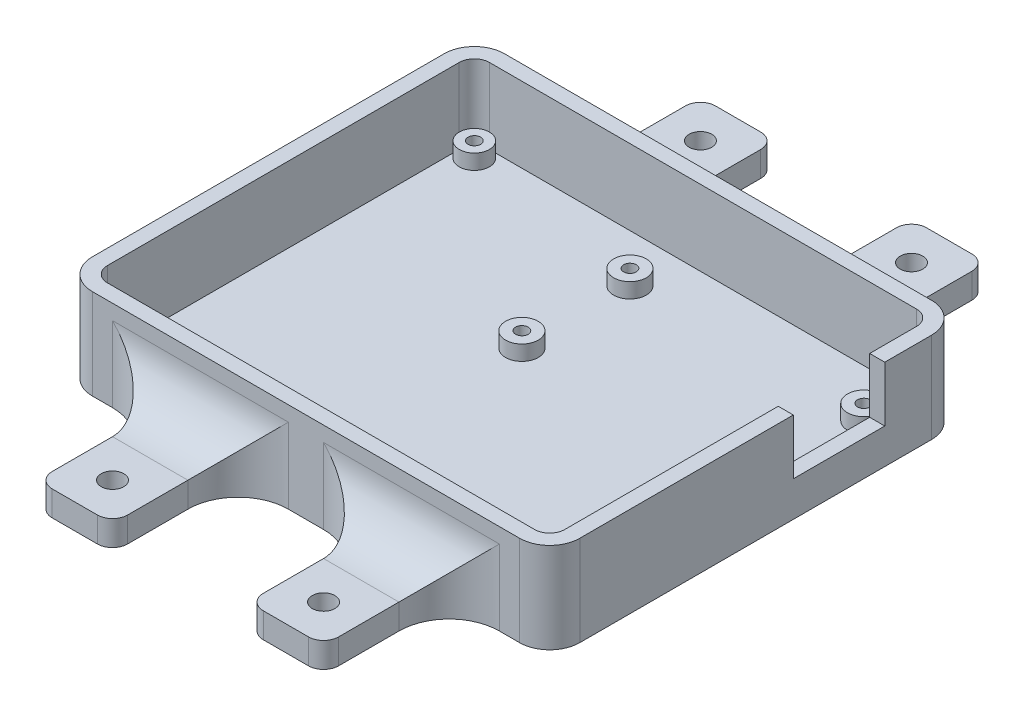
from build123d import *

# Parameters (mm, degrees)
BOSS_EXTRUDE1_DEPTH = 3
BOSS_EXTRUDE2_START = 15
BOSS_EXTRUDE2_DEPTH = 15
BOSS_EXTRUDE3_START = 3
SKETCH1_5_R         = 3
SKETCH1_5_R_2       = 1.25
SKETCH1_5_R_3       = 3.25
BOSS_EXTRUDE3_DEPTH = 3
SKETCH1_6_R         = 1.25
CUT_EXTRUDE1_DEPTH  = 124.701253025
CUT_EXTRUDE2_REACH  = 127.996
SKETCH3_W           = 18.2
SKETCH3_H           = 11
SKETCH4_R           = 2.25
BOSS_EXTRUDE4_DEPTH = 5
FILLET1_R           = 10


with BuildPart() as part:
    # Sketch1 → Boss-Extrude1 (new body)
    with BuildSketch(Plane(origin=(0, 0, 0), x_dir=(1, 0, 0), z_dir=(0, 1, 0))):
        with BuildLine():
            Line((-3, 3), (-88, 3))
            ThreePointArc((-88, 3), (-92.242640687, 1.242640687), (-94, -3))
            Line((-94, -3), (-94, -73))
            ThreePointArc((-94, -73), (-92.242640687, -77.242640687), (-88, -79))
            Line((-88, -79), (-3, -79))
            ThreePointArc((-3, -79), (1.242640687, -77.242640687), (3, -73))
            Line((3, -73), (3, -3))
            ThreePointArc((3, -3), (1.242640687, 1.242640687), (-3, 3))
        make_face()
    extrude(amount=-BOSS_EXTRUDE1_DEPTH)

    # Sketch1<4> → Boss-Extrude2 (add)
    with BuildSketch(Plane(origin=(0, 0, 0), x_dir=(1, 0, 0), z_dir=(0, 1, 0)).offset(BOSS_EXTRUDE2_START)):
        with BuildLine():
            ThreePointArc((3, -3), (1.242640687, 1.242640687), (-3, 3))
            Line((-3, 3), (-88, 3))
            ThreePointArc((-88, 3), (-92.242640687, 1.242640687), (-94, -3))
            Line((-94, -3), (-94, -73))
            ThreePointArc((-94, -73), (-92.242640687, -77.242640687), (-88, -79))
            Line((-88, -79), (-3, -79))
            ThreePointArc((-3, -79), (1.242640687, -77.242640687), (3, -73))
            Line((3, -73), (3, -3))
        make_face()
        with BuildLine():
            Line((-88, 0), (-3, 0))
            ThreePointArc((-3, 0), (-0.878679656, -0.878679656), (0, -3))
            Line((0, -3), (0, -73))
            ThreePointArc((0, -73), (-0.878679656, -75.121320344), (-3, -76))
            Line((-3, -76), (-88, -76))
            ThreePointArc((-88, -76), (-90.121320344, -75.121320344), (-91, -73))
            Line((-91, -73), (-91, -3))
            ThreePointArc((-91, -3), (-90.121320344, -0.878679656), (-88, 0))
        make_face(mode=Mode.SUBTRACT)
    extrude(amount=-BOSS_EXTRUDE2_DEPTH)

    # Sketch1<5> → Boss-Extrude3 (add)
    # profile 1 of 8: a face of its own
    with BuildSketch(Plane(origin=(0, 0, 0), x_dir=(1, 0, 0), z_dir=(0, 1, 0)).offset(BOSS_EXTRUDE3_START)):
        with Locations((-3, -3)):
            Circle(SKETCH1_5_R)
        with Locations((-3, -3)):
            Circle(SKETCH1_5_R_2, mode=Mode.SUBTRACT)
    # profile 2 of 8: a face of its own
    with BuildSketch(Plane(origin=(0, 0, 0), x_dir=(1, 0, 0), z_dir=(0, 1, 0)).offset(BOSS_EXTRUDE3_START)):
        with Locations((-88, -3)):
            Circle(SKETCH1_5_R)
        with Locations((-88, -3)):
            Circle(SKETCH1_5_R_2, mode=Mode.SUBTRACT)
    # profile 3 of 8: a face of its own
    with BuildSketch(Plane(origin=(0, 0, 0), x_dir=(1, 0, 0), z_dir=(0, 1, 0)).offset(BOSS_EXTRUDE3_START)):
        with Locations((-3, -73)):
            Circle(SKETCH1_5_R)
        with Locations((-3, -73)):
            Circle(SKETCH1_5_R_2, mode=Mode.SUBTRACT)
    # profile 4 of 8: a face of its own
    with BuildSketch(Plane(origin=(0, 0, 0), x_dir=(1, 0, 0), z_dir=(0, 1, 0)).offset(BOSS_EXTRUDE3_START)):
        with Locations((-88, -73)):
            Circle(SKETCH1_5_R)
        with Locations((-88, -73)):
            Circle(SKETCH1_5_R_2, mode=Mode.SUBTRACT)
    # profile 5 of 8: a face of its own
    with BuildSketch(Plane(origin=(0, 0, 0), x_dir=(1, 0, 0), z_dir=(0, 1, 0)).offset(BOSS_EXTRUDE3_START)):
        with Locations((-3.99, -9.5)):
            Circle(SKETCH1_5_R_3)
        with Locations((-3.99, -9.5)):
            Circle(SKETCH1_5_R_2, mode=Mode.SUBTRACT)
    # profile 6 of 8: a face of its own
    with BuildSketch(Plane(origin=(0, 0, 0), x_dir=(1, 0, 0), z_dir=(0, 1, 0)).offset(BOSS_EXTRUDE3_START)):
        with Locations((-3.99, -31)):
            Circle(SKETCH1_5_R_3)
        with Locations((-3.99, -31)):
            Circle(SKETCH1_5_R_2, mode=Mode.SUBTRACT)
    # profile 7 of 8: a face of its own
    with BuildSketch(Plane(origin=(0, 0, 0), x_dir=(1, 0, 0), z_dir=(0, 1, 0)).offset(BOSS_EXTRUDE3_START)):
        with Locations((-50.53, -31)):
            Circle(SKETCH1_5_R_3)
        with Locations((-50.53, -31)):
            Circle(SKETCH1_5_R_2, mode=Mode.SUBTRACT)
    # profile 8 of 8: a face of its own
    with BuildSketch(Plane(origin=(0, 0, 0), x_dir=(1, 0, 0), z_dir=(0, 1, 0)).offset(BOSS_EXTRUDE3_START)):
        with Locations((-50.53, -9.5)):
            Circle(SKETCH1_5_R_3)
        with Locations((-50.53, -9.5)):
            Circle(SKETCH1_5_R_2, mode=Mode.SUBTRACT)
    extrude(amount=-BOSS_EXTRUDE3_DEPTH)

    # Sketch1<6> → Cut-Extrude1 (cut, through all)
    with BuildSketch(Plane(origin=(0, 0, 0), x_dir=(1, 0, 0), z_dir=(0, 1, 0))):
        with Locations((-3.99, -9.5)):
            Circle(SKETCH1_6_R)
        with Locations((-50.53, -9.5)):
            Circle(SKETCH1_6_R)
        with Locations((-3.99, -31)):
            Circle(SKETCH1_6_R)
        with Locations((-50.53, -31)):
            Circle(SKETCH1_6_R)
        with Locations((-3, -3)):
            Circle(SKETCH1_6_R)
        with Locations((-88, -3)):
            Circle(SKETCH1_6_R)
        with Locations((-88, -73)):
            Circle(SKETCH1_6_R)
        with Locations((-3, -73)):
            Circle(SKETCH1_6_R)
    extrude(amount=-CUT_EXTRUDE1_DEPTH, mode=Mode.SUBTRACT)

    # Sketch3 → Cut-Extrude2 (cut, up to next)
    with BuildSketch(Plane(origin=(3, 0, 0), x_dir=(0, 0, -1), z_dir=(1, 0, 0)), mode=Mode.PRIVATE) as cut_extrude2_sk1:
        with Locations((-21.42, 9.5)):
            Rectangle(SKETCH3_W, SKETCH3_H)
    cut_extrude2_tool1 = extrude(cut_extrude2_sk1.sketch, amount=-CUT_EXTRUDE2_REACH, mode=Mode.PRIVATE) & part.part
    add(cut_extrude2_tool1.solids().sort_by_distance((3, 9.5, 21.42))[0], mode=Mode.SUBTRACT)

    # Sketch4 → Boss-Extrude4 (add)
    # profile 1 of 4: a face of its own
    with BuildSketch(Plane.XZ.offset(3)):
        with BuildLine():
            Line((-17, 79), (-32, 79))
            Line((-32, 79), (-32, 101))
            ThreePointArc((-32, 101), (-31.121320344, 103.121320344), (-29, 104))
            Line((-29, 104), (-20, 104))
            ThreePointArc((-20, 104), (-17.878679656, 103.121320344), (-17, 101))
            Line((-17, 101), (-17, 79))
        make_face()
        with Locations((-24.5, 96.5)):
            Circle(SKETCH4_R, mode=Mode.SUBTRACT)
    # profile 2 of 4: a face of its own
    with BuildSketch(Plane.XZ.offset(3)):
        with BuildLine():
            Line((-17, -3), (-32, -3))
            Line((-32, -3), (-32, -25))
            ThreePointArc((-32, -25), (-31.121320344, -27.121320344), (-29, -28))
            Line((-29, -28), (-20, -28))
            ThreePointArc((-20, -28), (-17.878679656, -27.121320344), (-17, -25))
            Line((-17, -25), (-17, -3))
        make_face()
        with Locations((-24.5, -20.5)):
            Circle(SKETCH4_R, mode=Mode.SUBTRACT)
    # profile 3 of 4: a face of its own
    with BuildSketch(Plane.XZ.offset(3)):
        with BuildLine():
            Line((-59, 79), (-74, 79))
            Line((-74, 79), (-74, 101))
            ThreePointArc((-74, 101), (-73.121320344, 103.121320344), (-71, 104))
            Line((-71, 104), (-62, 104))
            ThreePointArc((-62, 104), (-59.878679656, 103.121320344), (-59, 101))
            Line((-59, 101), (-59, 79))
        make_face()
        with Locations((-66.5, 96.5)):
            Circle(SKETCH4_R, mode=Mode.SUBTRACT)
    # profile 4 of 4: a face of its own
    with BuildSketch(Plane.XZ.offset(3)):
        with BuildLine():
            Line((-59, -3), (-74, -3))
            Line((-74, -3), (-74, -25))
            ThreePointArc((-74, -25), (-73.121320344, -27.121320344), (-71, -28))
            Line((-71, -28), (-62, -28))
            ThreePointArc((-62, -28), (-59.878679656, -27.121320344), (-59, -25))
            Line((-59, -25), (-59, -3))
        make_face()
        with Locations((-66.5, -20.5)):
            Circle(SKETCH4_R, mode=Mode.SUBTRACT)
    extrude(amount=-BOSS_EXTRUDE4_DEPTH)

    # Fillet1
    fillet1_edges = [part.edges().sort_by_distance(p)[0] for p in [
        (-17, -0.5, 79),
        (-24.5, 2, 79),
        (-32, -0.5, 79),
        (-59, -0.5, 79),
        (-66.5, 2, 79),
        (-74, -0.5, 79),
        (-74, -0.5, -3),
        (-17, -0.5, -3),
        (-32, -0.5, -3),
        (-59, -0.5, -3),
        (-66.5, 2, -3),
        (-24.5, 2, -3),
    ]]
    fillet(fillet1_edges, radius=FILLET1_R)


solid = part.part
